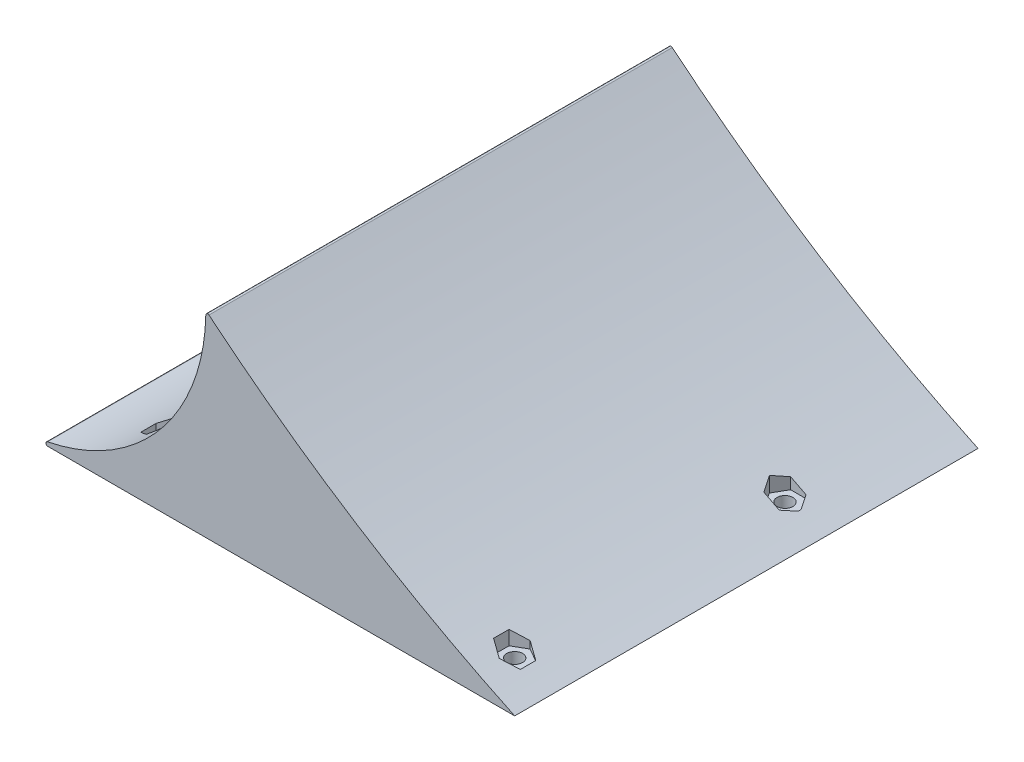
from build123d import *

# Parameters (mm, degrees)
EXTRUDE_1_DEPTH     = 120
FILLET_1_R          = 0.5
CUT_EXTRUDE_1_DEPTH = 48
SKETCH_5_R          = 2.0500000000000123
SKETCH_5_R_2        = 2.0500000000000056
SKETCH_5_R_3        = 2.0499999999999923
CUT_EXTRUDE_2_DEPTH = 5
SKETCH_6_R          = 70.99685128536404
CUT_EXTRUDE_3_DEPTH = 185.82965146426048


with BuildPart() as part:
    # 草图3 → 凸台-拉伸1 (new, symmetric)
    with BuildSketch(Plane.XY):
        with BuildLine():
            Line((131, -50.99999999999999), (6.25e-15, -51))
            ThreePointArc((6.25e-15, -51), (36.062445840513924, -36.062445840513924), (51, 0))
            ThreePointArc((51, 0), (89.3844868048509, -28.034138345331712), (131, -50.99999999999999))
        make_face()
    extrude(amount=EXTRUDE_1_DEPTH, both=True)

    # 圆角1
    fillet_1_edges = [part.edges().sort_by_distance(p)[0] for p in [
        (50.99999999999999, -2.664e-14, 0),
        (6.25e-15, -51, 0),
    ]]
    fillet(fillet_1_edges, radius=FILLET_1_R)

    # 草图4 → 切除-拉伸1 (cut)
    with BuildSketch(Plane(origin=(0, 0, 0), x_dir=(1, 0, 0), z_dir=(0, 1, 0))):
        Polygon((124.4641016151378, -112), (124.4641016151378, -108), (121.00000000000006, -106.00000000000001), (117.5358983848623, -108), (117.5358983848623, -112), (121.00000000000004, -113.99999999999999), align=None)
        Polygon((29.599504938362088, -106.00000000000001), (26.135403323224345, -108.00000000000001), (26.135403323224345, -112), (29.599504938362088, -113.99999999999999), (33.06360655349983, -112), (33.06360655349983, -108.00000000000001), align=None)
        Polygon((33.06360655349983, 108.00000000000001), (29.599504938362088, 106.00000000000001), (26.135403323224345, 108.00000000000001), (26.135403323224345, 112), (29.599504938362088, 113.99999999999999), (33.06360655349983, 112), align=None)
        Polygon((121.00000000000004, 113.99999999999999), (124.4641016151378, 112), (124.4641016151378, 108), (121.00000000000006, 106.00000000000001), (117.5358983848623, 108), (117.5358983848623, 112), align=None)
        Polygon((123.00000000000004, -36.53589838486225), (119.00000000000006, -36.53589838486225), (117.00000000000004, -39.99999999999999), (119.00000000000004, -43.46410161513774), (123.00000000000003, -43.46410161513774), (125.00000000000006, -39.99999999999999), align=None)
        Polygon((125.00000000000003, 40.00000000000008), (123.00000000000001, 43.464101615137785), (119.00000000000001, 43.464101615137785), (116.99999999999999, 40), (118.99999999999997, 36.535898384862286), (123.00000000000006, 36.535898384862286), align=None)
    extrude(amount=-CUT_EXTRUDE_1_DEPTH, mode=Mode.SUBTRACT)

    # 草图5 → 切除-拉伸2 (cut)
    with BuildSketch(Plane(origin=(2.54e-15, -47.99999999999999, 0), x_dir=(1, 5e-17, 0), z_dir=(-5e-17, 1, 0))):
        with Locations(Location((29.599504938362074, -110.00000000000001, 0), (0, 0, 180))):
            Circle(SKETCH_5_R)
        with Locations((29.599504938362074, 110.00000000000001)):
            Circle(SKETCH_5_R)
        with Locations(Location((121, 110.00000000000001, 0), (0, 0, 180))):
            Circle(SKETCH_5_R_2)
        with Locations((121.00000000000006, -110)):
            Circle(SKETCH_5_R_2)
        with Locations(Location((120.94806034143625, 40.089962127560234, 0), (0, 0, 180))):
            Circle(SKETCH_5_R_3)
        with Locations(Location((121.00000000000006, -40, 0), (0, 0, 180))):
            Circle(SKETCH_5_R_3)
    extrude(amount=-CUT_EXTRUDE_2_DEPTH, mode=Mode.SUBTRACT)

    # 草图6 → 切除-拉伸3 (cut, through all)
    with BuildSketch(Plane.XY):
        with Locations((70.54975246918104, -50.99999999999999)):
            Circle(SKETCH_6_R)
    extrude(amount=-CUT_EXTRUDE_3_DEPTH, mode=Mode.SUBTRACT)


solid = part.part
